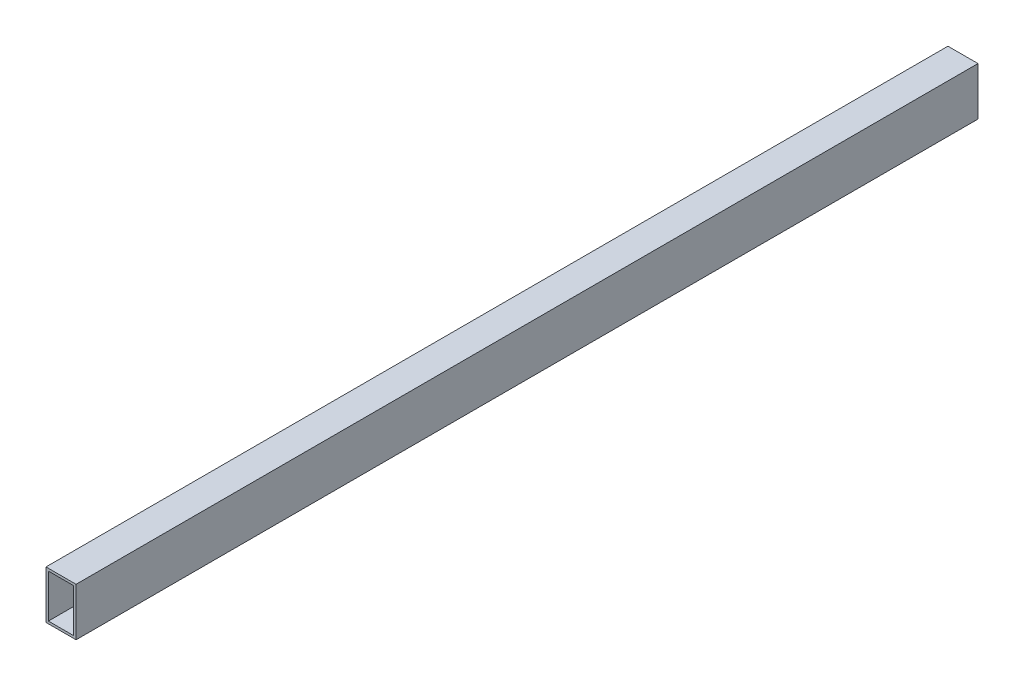
from build123d import *

# Parameters (mm, degrees)
SKETCH1_W           = 50
SKETCH1_H           = 80
BOSS_EXTRUDE1_DEPTH = 1500
SKETCH2_W           = 42
SKETCH2_H           = 72
CUT_EXTRUDE1_DEPTH  = 1500


with BuildPart() as part:
    # Sketch1 → Boss-Extrude1 (new body)
    with BuildSketch(Plane.XY):
        Rectangle(SKETCH1_W, SKETCH1_H)
    extrude(amount=BOSS_EXTRUDE1_DEPTH)

    # Sketch2 → Cut-Extrude1 (cut)
    with BuildSketch(Plane(origin=(0, 0, 0), x_dir=(-1, 0, 0), z_dir=(0, 0, -1))):
        Rectangle(SKETCH2_W, SKETCH2_H)
    extrude(amount=-CUT_EXTRUDE1_DEPTH, mode=Mode.SUBTRACT)


solid = part.part
